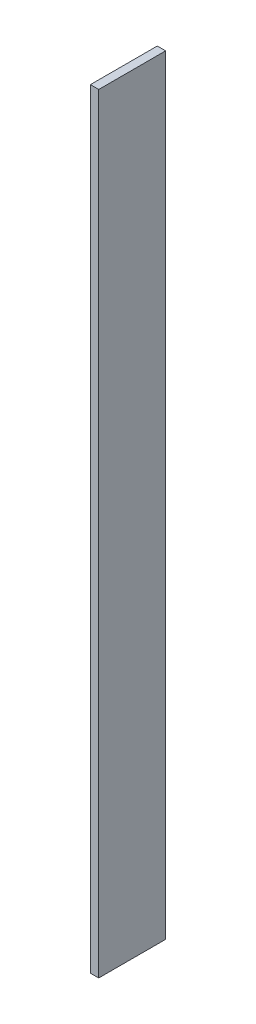
from build123d import *

# Parameters (mm, degrees)
SKETCH1_W           = 0.5
SKETCH1_H           = 4
BOSS_EXTRUDE1_DEPTH = 23


with BuildPart() as part:
    # Sketch1 → Boss-Extrude1 (new, symmetric)
    with BuildSketch(Plane(origin=(0, 0, 0), x_dir=(1, 0, 0), z_dir=(0, 1, 0))):
        Rectangle(SKETCH1_W, SKETCH1_H)
    extrude(amount=BOSS_EXTRUDE1_DEPTH, both=True)


solid = part.part
